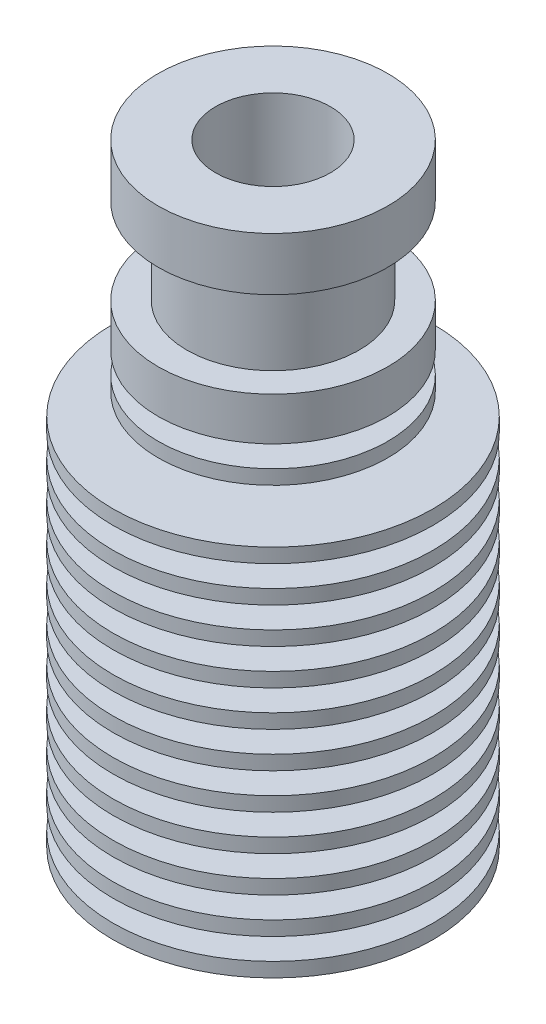
from build123d import *


with BuildPart() as part:
    # Sketch1 → Revolve1 (revolve)
    with BuildSketch(Plane.XY, mode=Mode.PRIVATE) as revolve1_sk:
        Polygon((4, 21.35), (8, 21.35), (8, 17.65), (6, 17.65), (6, 11.65), (8, 11.65), (8, 8.65), (4.4, 8.65), (4.4, 7.15), (8, 7.15), (8, 6.15), (4.4, 6.15), (4.4, 4.65), (11.15, 4.65), (11.15, 3.65), (4.6, 3.65), (4.6, 2.15), (11.15, 2.15), (11.15, 1.15), (4.8, 1.15), (4.8, -0.35), (11.15, -0.35), (11.15, -1.35), (4.95, -1.35), (4.95, -2.85), (11.15, -2.85), (11.15, -3.85), (5.15, -3.85), (5.15, -5.35), (11.15, -5.35), (11.15, -6.35), (5.35, -6.35), (5.35, -7.85), (11.15, -7.85), (11.15, -8.85), (5.5, -8.85), (5.5, -10.35), (11.15, -10.35), (11.15, -11.35), (5.7, -11.35), (5.7, -12.85), (11.15, -12.85), (11.15, -13.85), (5.9, -13.85), (5.9, -15.35), (11.15, -15.35), (11.15, -16.35), (6.05, -16.35), (6.05, -17.85), (11.15, -17.85), (11.15, -18.85), (6.25, -18.85), (6.25, -20.35), (11.15, -20.35), (11.15, -21.35), (3.5, -21.35), (3.5, -6.55), (2.1, -5.741709623), (2.1, 14.019605677), (4, 15.35), align=None)
    revolve(revolve1_sk.sketch.rotate(Axis((0, 21.35, 0), (0, -1, 0)), 90), axis=Axis((0, 21.35, 0), (0, -1, 0)))


solid = part.part
